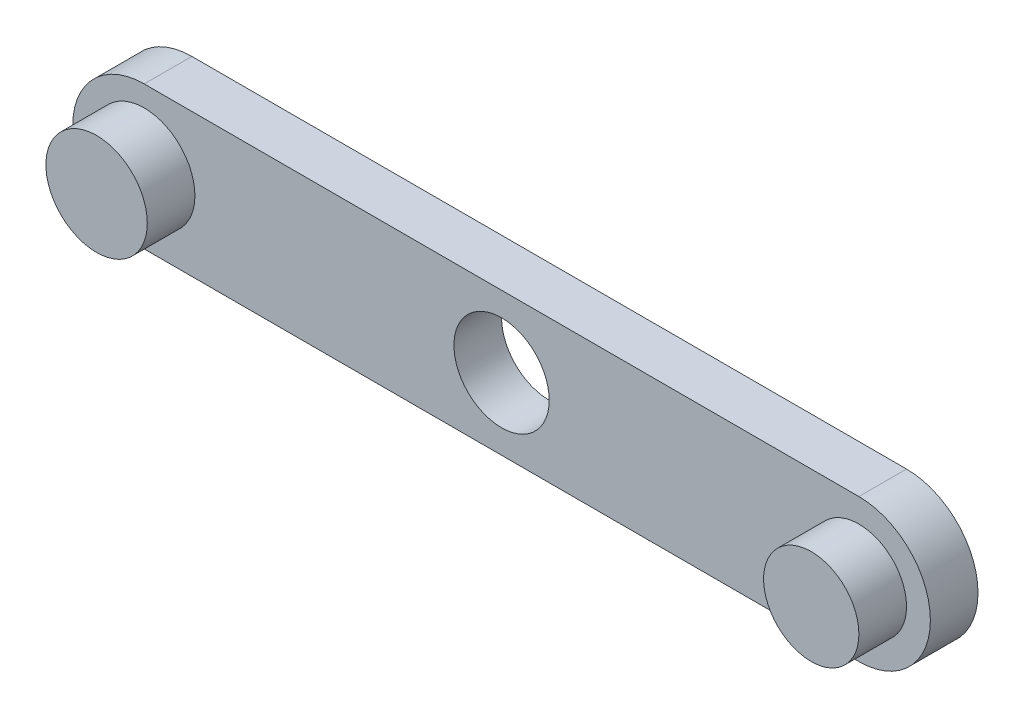
from build123d import *

# Parameters (mm, degrees)
SKETCH1_R           = 10
BOSS_EXTRUDE1_DEPTH = 10
SKETCH2_R           = 10.638632356
SKETCH2_R_2         = 10
BOSS_EXTRUDE2_DEPTH = 10


with BuildPart() as part:
    # Sketch1 → Boss-Extrude1 (new body)
    with BuildSketch(Plane.XY):
        with BuildLine():
            Line((0, 15), (150, 15))
            ThreePointArc((150, 15), (165, 0), (150, -15))
            Line((150, -15), (0, -15))
            ThreePointArc((0, -15), (-15, 0), (0, 15))
        make_face()
        with Locations((75, 0)):
            Circle(SKETCH1_R, mode=Mode.SUBTRACT)
    extrude(amount=BOSS_EXTRUDE1_DEPTH)

    # Sketch2 → Boss-Extrude2 (add)
    with BuildSketch(Plane.XY.offset(10)):
        Circle(SKETCH2_R)
        with Locations((150, 0)):
            Circle(SKETCH2_R_2)
    extrude(amount=BOSS_EXTRUDE2_DEPTH)


solid = part.part
